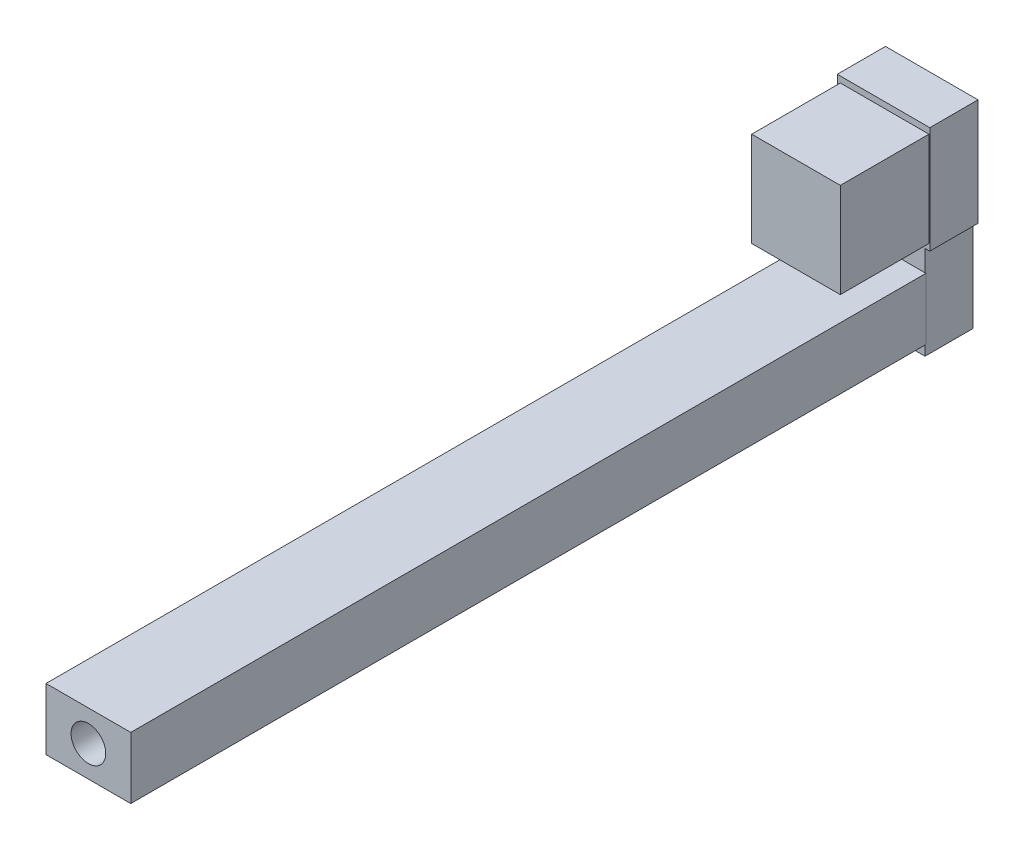
from build123d import *

# Parameters (mm, degrees)
SKETCH1_W           = 1310.386
SKETCH1_H           = 101.6
BOSS_EXTRUDE1_DEPTH = 69.85
BOSS_EXTRUDE2_DEPTH = 68.326
SKETCH3_W           = 79.430838384
SKETCH3_H           = 176.27
BOSS_EXTRUDE3_DEPTH = 76.23
SKETCH4_W           = 146.04
SKETCH4_H           = 156.04
BOSS_EXTRUDE4_DEPTH = 146.05
SKETCH5_R           = 28.575
CUT_EXTRUDE1_DEPTH  = 927.1


with BuildPart() as part:
    # Sketch1 → Boss-Extrude1 (new, symmetric)
    with BuildSketch(Plane(origin=(0, 0, 0), x_dir=(0, 0, -1), z_dir=(1, 0, 0))):
        with Locations((-655.193, 0)):
            Rectangle(SKETCH1_W, SKETCH1_H)
    extrude(amount=BOSS_EXTRUDE1_DEPTH, both=True)

    # Sketch2 → Boss-Extrude2 (add, symmetric)
    with BuildSketch(Plane(origin=(0, 0, 0), x_dir=(0, 0, -1), z_dir=(1, 0, 0))):
        Polygon((0, 0), (0, -68.326), (79.430838384, -68.326), (79.430838384, 85.598), (0, 85.598), align=None)
    extrude(amount=BOSS_EXTRUDE2_DEPTH, both=True)

    # Sketch3 → Boss-Extrude3 (add, symmetric)
    with BuildSketch(Plane(origin=(0, 0, 0), x_dir=(0, 0, -1), z_dir=(1, 0, 0))):
        with Locations((39.715419192, 173.733)):
            Rectangle(SKETCH3_W, SKETCH3_H)
    extrude(amount=BOSS_EXTRUDE3_DEPTH, both=True)

    # Sketch4 → Boss-Extrude4 (add)
    with BuildSketch(Plane.XY):
        with Locations((1.79, 173.848)):
            Rectangle(SKETCH4_W, SKETCH4_H)
    extrude(amount=BOSS_EXTRUDE4_DEPTH)

    # Sketch5 → Cut-Extrude1 (cut)
    with BuildSketch(Plane.XY.offset(1310.386)):
        Circle(SKETCH5_R)
    extrude(amount=-CUT_EXTRUDE1_DEPTH, mode=Mode.SUBTRACT)


solid = part.part
